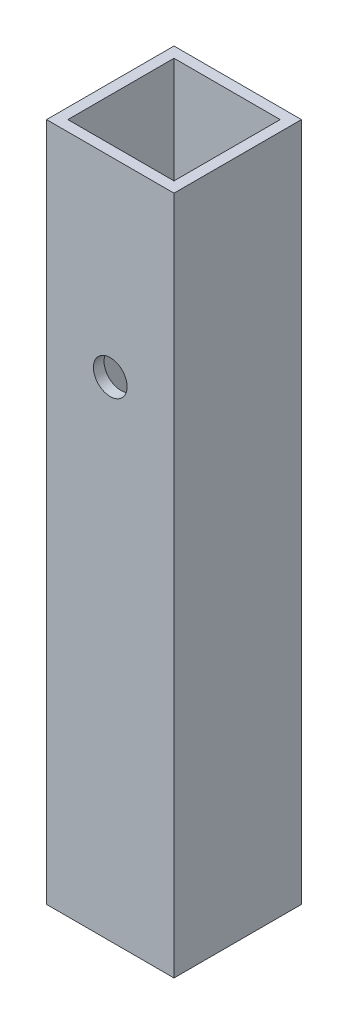
from build123d import *

# Parameters (mm, degrees)
SKETCH1_W                = 38.1
SKETCH1_H                = 38.1
SKETCH1_W_2              = 31.75
SKETCH1_H_2              = 31.75
BOSS_EXTRUDE1_DEPTH      = 203.2
X_0_397_DIAMETER_HOLE1_D = 10.0838


with BuildPart() as part:
    # Sketch1 → Boss-Extrude1 (new body)
    with BuildSketch(Plane(origin=(0, 0, 0), x_dir=(1, 0, 0), z_dir=(0, 1, 0))):
        with Locations((19.05, 19.05)):
            Rectangle(SKETCH1_W, SKETCH1_H)
        with Locations((19.05, 19.05)):
            Rectangle(SKETCH1_W_2, SKETCH1_H_2, mode=Mode.SUBTRACT)
    extrude(amount=BOSS_EXTRUDE1_DEPTH)

    # X (0.397) Diameter Hole1 (through all)
    with Locations(Plane.XY):
        with Locations((19.05, 146.05)):
            Hole(X_0_397_DIAMETER_HOLE1_D / 2)


solid = part.part
